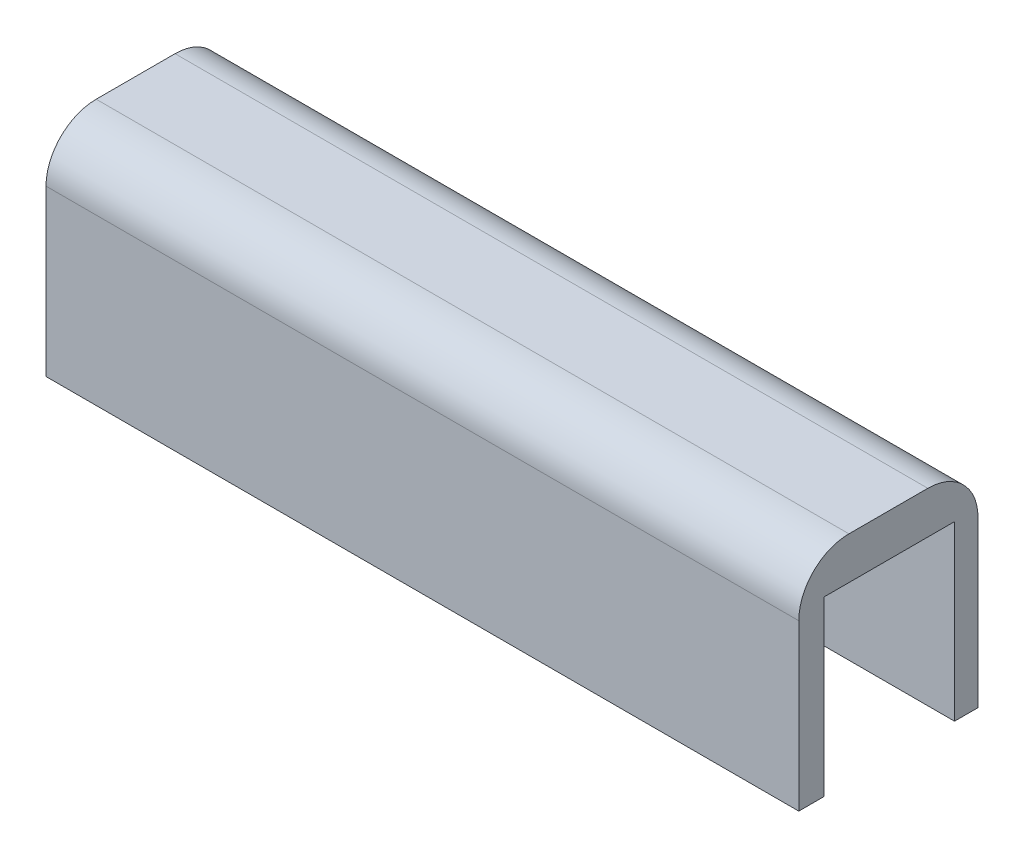
from build123d import *

# Parameters (mm, degrees)
BOSS_EXTRUDE1_DEPTH = 52.5
FILLET1_R           = 7


with BuildPart() as part:
    # Sketch1 → Boss-Extrude1 (new, symmetric)
    with BuildSketch(Plane(origin=(0, 0, 0), x_dir=(0, 0, -1), z_dir=(1, 0, 0))):
        Polygon((-15.630670187, -4.507264222), (-15.630670187, 25.492735778), (9.369329813, 25.492735778), (9.369329813, -4.507264222), (6.093628879, -4.507264222), (6.093628879, 19.604885311), (-12.130670187, 19.604885311), (-12.130670187, -4.507264222), align=None)
    extrude(amount=BOSS_EXTRUDE1_DEPTH, both=True)

    # Fillet1
    fillet1_edges = [part.edges().sort_by_distance(p)[0] for p in [
        (0, 25.492735778, 15.630670187),
        (0, 25.492735778, -9.369329813),
    ]]
    fillet(fillet1_edges, radius=FILLET1_R)


solid = part.part
